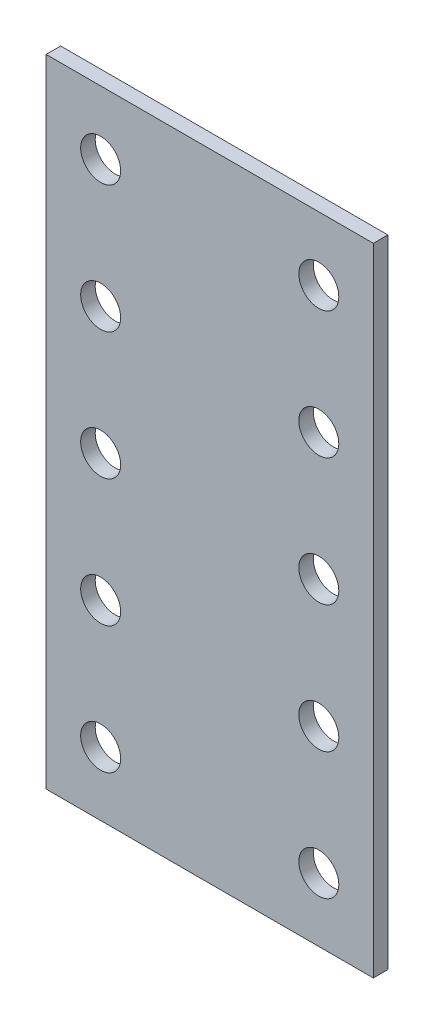
from build123d import *

# Parameters (mm, degrees)
SKETCH1_W                  = 180
SKETCH1_H                  = 350
BOSS_EXTRUDE1_DEPTH        = 4
F_22_0_22_DIAMETER_HOLE1_D = 22
LPATTERN1_COUNT            = 5
LPATTERN1_PITCH            = 70


with BuildPart() as part:
    # Sketch1 → Boss-Extrude1 (new, symmetric)
    with BuildSketch(Plane.XY):
        Rectangle(SKETCH1_W, SKETCH1_H)
    extrude(amount=BOSS_EXTRUDE1_DEPTH, both=True)

    # Ø22.0 (22) Diameter Hole1 (through all)
    with Locations(Plane.XY.offset(4)):
        with Locations((-60, 140), (60, 140)):
            f_22_0_22_diameter_hole1 = Hole(F_22_0_22_DIAMETER_HOLE1_D / 2)

    # LPattern1: Ø22.0 (22) Diameter Hole1 ×5
    with Locations(*[(0, -i * LPATTERN1_PITCH, 0) for i in range(1, LPATTERN1_COUNT)]):
        add(f_22_0_22_diameter_hole1, mode=Mode.SUBTRACT)


solid = part.part
